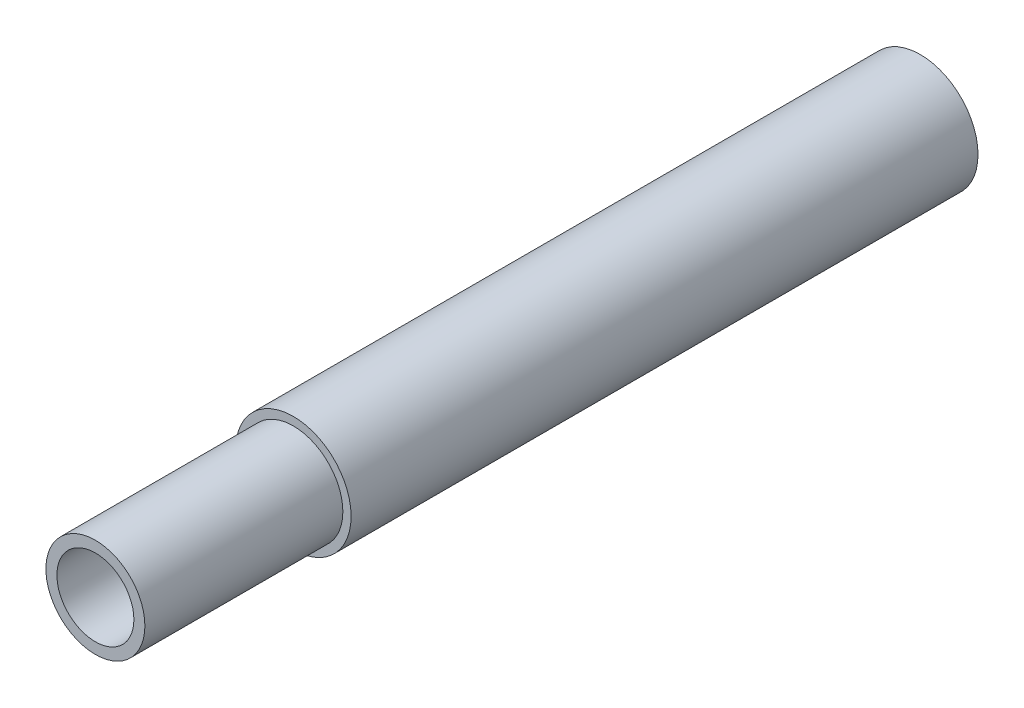
from build123d import *

# Parameters (mm, degrees)
SKETCH2_R           = 10.5
SKETCH2_R_2         = 7
BOSS_EXTRUDE1_DEPTH = 114
BOSS_EXTRUDE2_START = 36
SKETCH4_R           = 9
SKETCH4_R_2         = 7
BOSS_EXTRUDE2_DEPTH = 36


with BuildPart() as part:
    # Sketch2 → Boss-Extrude1 (new body)
    with BuildSketch(Plane.XY):
        Circle(SKETCH2_R)
        Circle(SKETCH2_R_2, mode=Mode.SUBTRACT)
    extrude(amount=-BOSS_EXTRUDE1_DEPTH)

    # Sketch4 → Boss-Extrude2 (add)
    with BuildSketch(Plane.XY.offset(BOSS_EXTRUDE2_START)):
        Circle(SKETCH4_R)
        Circle(SKETCH4_R_2, mode=Mode.SUBTRACT)
    extrude(amount=-BOSS_EXTRUDE2_DEPTH)


solid = part.part
